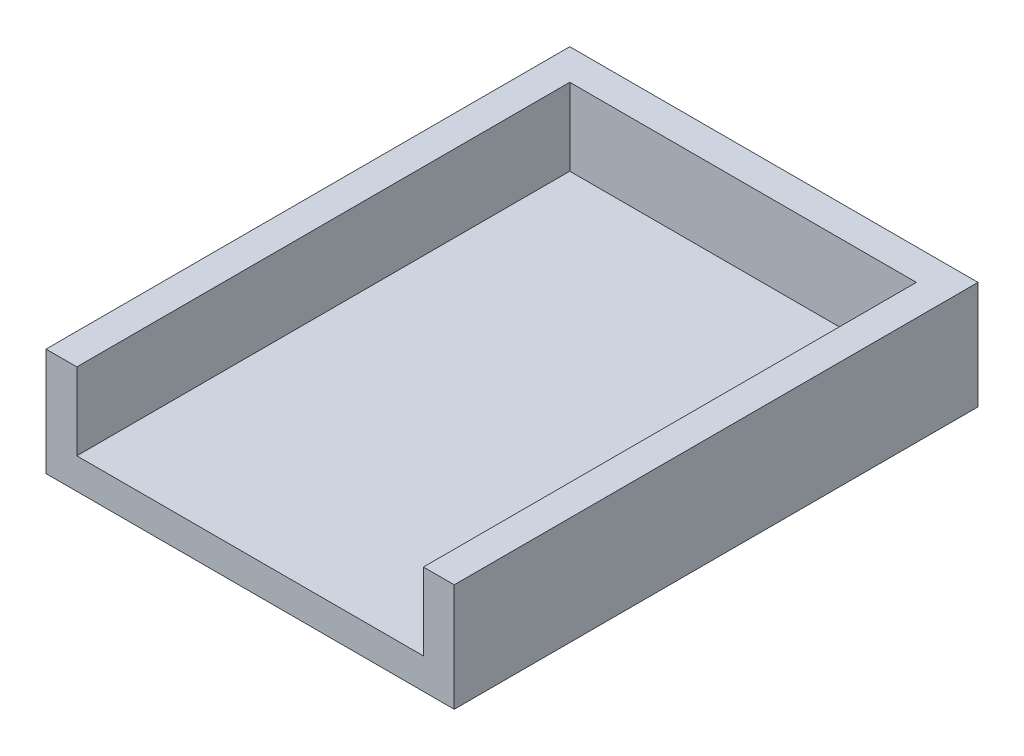
from build123d import *

# Parameters (mm, degrees)
SKETCH1_W           = 22.5
SKETCH1_H           = 32
BOSS_EXTRUDE1_DEPTH = 2
BOSS_EXTRUDE3_START = -2
BOSS_EXTRUDE3_DEPTH = 7


with BuildPart() as part:
    # Sketch1 → Boss-Extrude1 (new body)
    with BuildSketch(Plane(origin=(0, 0, 0), x_dir=(1, 0, 0), z_dir=(0, 1, 0))):
        Rectangle(SKETCH1_W, SKETCH1_H)
    extrude(amount=BOSS_EXTRUDE1_DEPTH)

    # Sketch3 → Boss-Extrude3 (add)
    with BuildSketch(Plane(origin=(0, 2, 0), x_dir=(1, 0, 0), z_dir=(0, 1, 0)).offset(BOSS_EXTRUDE3_START)):
        Polygon((-11.25, -16), (-11.25, 16), (11.25, 16), (11.25, -16), (13.25, -16), (13.25, 18), (-13.25, 18), (-13.25, -16), align=None)
    extrude(amount=BOSS_EXTRUDE3_DEPTH)


solid = part.part
